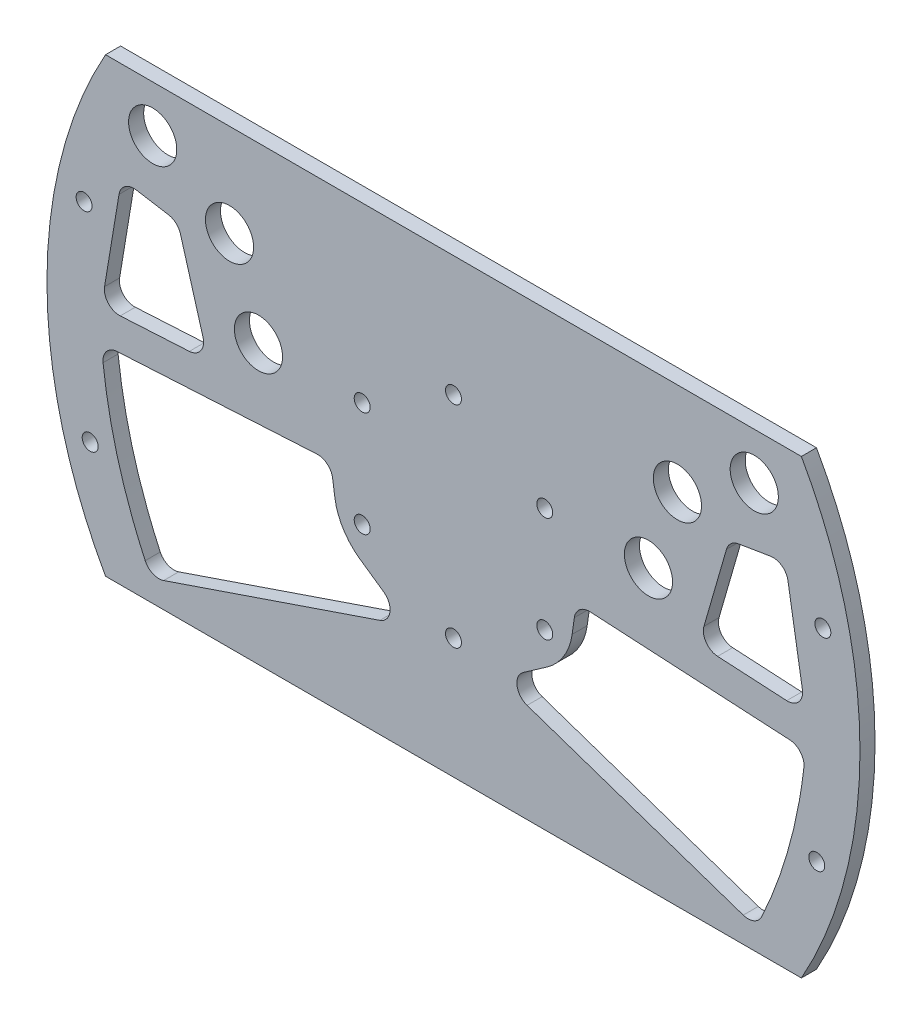
from build123d import *

# Parameters (mm, degrees)
SKETCH4_R           = 2.65
SKETCH4_R_2         = 8
BOSS_EXTRUDE1_DEPTH = 5


with BuildPart() as part:
    # Sketch4 → Boss-Extrude1 (new body)
    with BuildSketch(Plane.XY):
        with BuildLine():
            Line((-115.538340842, -75), (115.538340842, -75))
            add(Edge.make_bspline(
                [(115.538340842, -75), (157.739845208, 0), (115.538340842, 75)],
                knots=[1.027171819, 1.027171819, 1.027171819, 2.114420834, 2.114420834, 2.114420834], degree=2, weights=[1, 0.855839562, 1]))
            Line((115.538340842, 75), (-115.538340842, 75))
            add(Edge.make_bspline(
                [(-115.538340842, 75), (-157.739845208, 0), (-115.538340842, -75)],
                knots=[4.168764473, 4.168764473, 4.168764473, 5.256013488, 5.256013488, 5.256013488], degree=2, weights=[1, 0.855839562, 1]))
        make_face()
        with Locations((0, 35)):
            Circle(SKETCH4_R, mode=Mode.SUBTRACT)
        with Locations((30.310889132, 17.5)):
            Circle(SKETCH4_R, mode=Mode.SUBTRACT)
        with Locations((30.310889132, -17.5)):
            Circle(SKETCH4_R, mode=Mode.SUBTRACT)
        with Locations((0, -35)):
            Circle(SKETCH4_R, mode=Mode.SUBTRACT)
        with Locations((-30.310889132, -17.5)):
            Circle(SKETCH4_R, mode=Mode.SUBTRACT)
        with Locations((-30.310889132, 17.5)):
            Circle(SKETCH4_R, mode=Mode.SUBTRACT)
        with Locations((64.752033934, 17.5)):
            Circle(SKETCH4_R_2, mode=Mode.SUBTRACT)
        with Locations((74.374721355, 44.185460771)):
            Circle(SKETCH4_R_2, mode=Mode.SUBTRACT)
        with Locations((99.888536583, 59.516130447)):
            Circle(SKETCH4_R_2, mode=Mode.SUBTRACT)
        with Locations(Location((-99.888536583, 59.516130447, 0), (0, 0, 180))):
            Circle(SKETCH4_R_2, mode=Mode.SUBTRACT)
        with Locations(Location((-74.374721355, 44.185460771, 0), (0, 0, 180))):
            Circle(SKETCH4_R_2, mode=Mode.SUBTRACT)
        with Locations(Location((-64.752033934, 17.5, 0), (0, 0, 180))):
            Circle(SKETCH4_R_2, mode=Mode.SUBTRACT)
        with Locations((120.644049354, -38.948255584)):
            Circle(SKETCH4_R, mode=Mode.SUBTRACT)
        with Locations((122.664887702, 29.201114123)):
            Circle(SKETCH4_R, mode=Mode.SUBTRACT)
        with Locations(Location((-122.664887702, 29.201114123, 0), (0, 0, 180))):
            Circle(SKETCH4_R, mode=Mode.SUBTRACT)
        with Locations(Location((-120.644049354, -38.948255584, 0), (0, 0, 180))):
            Circle(SKETCH4_R, mode=Mode.SUBTRACT)
        with BuildLine():
            Line((96.221427668, -66.569190125), (24.443369148, -42.131459749))
            ThreePointArc((24.443369148, -42.131459749), (21.104097738, -38.098339283), (23.194170579, -33.297465429))
            Line((23.194170579, -33.297465429), (31.044827796, -27.820928801))
            ThreePointArc((31.044827796, -27.820928801), (36.634624949, -21.900779304), (39.401541781, -14.243222677))
            Line((39.401541781, -14.243222677), (40.142546192, -9.050682376))
            ThreePointArc((40.142546192, -9.050682376), (41.921887066, -5.890808111), (45.369026009, -4.764712013))
            Line((45.369026009, -4.764712013), (111.686928814, -8.439409623))
            ThreePointArc((111.686928814, -8.439409623), (115.232710002, -10.208524402), (116.377662166, -14.002126368))
            add(Edge.make_bspline(
                [(116.377662166, -14.002126368), (115.220834159, -24.076872303), (111.675987444, -41.055400313), (105.466013317, -57.243285168), (102.371009367, -63.934943838)],
                knots=[0.084665499, 0.084665499, 0.084665499, 0.084665499, 0.572063361, 0.927683596, 0.927683596, 0.927683596, 0.927683596], degree=3))
            ThreePointArc((102.371009367, -63.934943838), (99.801685805, -66.432067651), (96.221427668, -66.569190125))
        make_face(mode=Mode.SUBTRACT)
        with BuildLine():
            Line((115.869646859, 8.131830129), (111.070686254, 37.070959775))
            ThreePointArc((111.070686254, 37.070959775), (109.047553267, 40.319281474), (105.320071912, 41.18562072))
            Line((105.320071912, 41.18562072), (94.654082301, 39.416885289))
            ThreePointArc((94.654082301, 39.416885289), (92.149315195, 38.220472158), (90.668652636, 35.872515381))
            Line((90.668652636, 35.872515381), (83.183473525, 9.973795657))
            ThreePointArc((83.183473525, 9.973795657), (83.908923245, 5.692386099), (87.710252524, 3.593186057))
            Line((87.710252524, 3.593186057), (110.66038185, 2.321511565))
            ThreePointArc((110.66038185, 2.321511565), (114.659851997, 3.97612342), (115.869646859, 8.131830129))
        make_face(mode=Mode.SUBTRACT)
        with BuildLine():
            Line((-96.221427668, -66.569190125), (-24.443369148, -42.131459749))
            ThreePointArc((-24.443369148, -42.131459749), (-21.104097738, -38.098339283), (-23.194170579, -33.297465429))
            Line((-23.194170579, -33.297465429), (-31.044827796, -27.820928801))
            ThreePointArc((-31.044827796, -27.820928801), (-36.634624949, -21.900779304), (-39.401541781, -14.243222677))
            Line((-39.401541781, -14.243222677), (-40.142546192, -9.050682376))
            ThreePointArc((-40.142546192, -9.050682376), (-41.921887066, -5.890808111), (-45.369026009, -4.764712013))
            Line((-45.369026009, -4.764712013), (-111.686928814, -8.439409623))
            ThreePointArc((-111.686928814, -8.439409623), (-115.232710002, -10.208524402), (-116.377662166, -14.002126368))
            add(Edge.make_bspline(
                [(-116.377662166, -14.002126368), (-115.220834159, -24.076872303), (-111.675987444, -41.055400313), (-105.466013317, -57.243285168), (-102.371009367, -63.934943838)],
                knots=[0.084665499, 0.084665499, 0.084665499, 0.084665499, 0.572063361, 0.927683596, 0.927683596, 0.927683596, 0.927683596], degree=3))
            ThreePointArc((-102.371009367, -63.934943838), (-99.801685805, -66.432067651), (-96.221427668, -66.569190125))
        make_face(mode=Mode.SUBTRACT)
        with BuildLine():
            Line((-90.668652636, 35.872515381), (-83.183473525, 9.973795657))
            ThreePointArc((-83.183473525, 9.973795657), (-83.908923245, 5.692386099), (-87.710252524, 3.593186057))
            Line((-87.710252524, 3.593186057), (-110.66038185, 2.321511565))
            ThreePointArc((-110.66038185, 2.321511565), (-114.659851997, 3.97612342), (-115.869646859, 8.131830129))
            Line((-115.869646859, 8.131830129), (-111.070686254, 37.070959775))
            ThreePointArc((-111.070686254, 37.070959775), (-109.047553267, 40.319281474), (-105.320071912, 41.18562072))
            Line((-105.320071912, 41.18562072), (-94.654082301, 39.416885289))
            ThreePointArc((-94.654082301, 39.416885289), (-92.149315195, 38.220472158), (-90.668652636, 35.872515381))
        make_face(mode=Mode.SUBTRACT)
    extrude(amount=BOSS_EXTRUDE1_DEPTH)


solid = part.part
